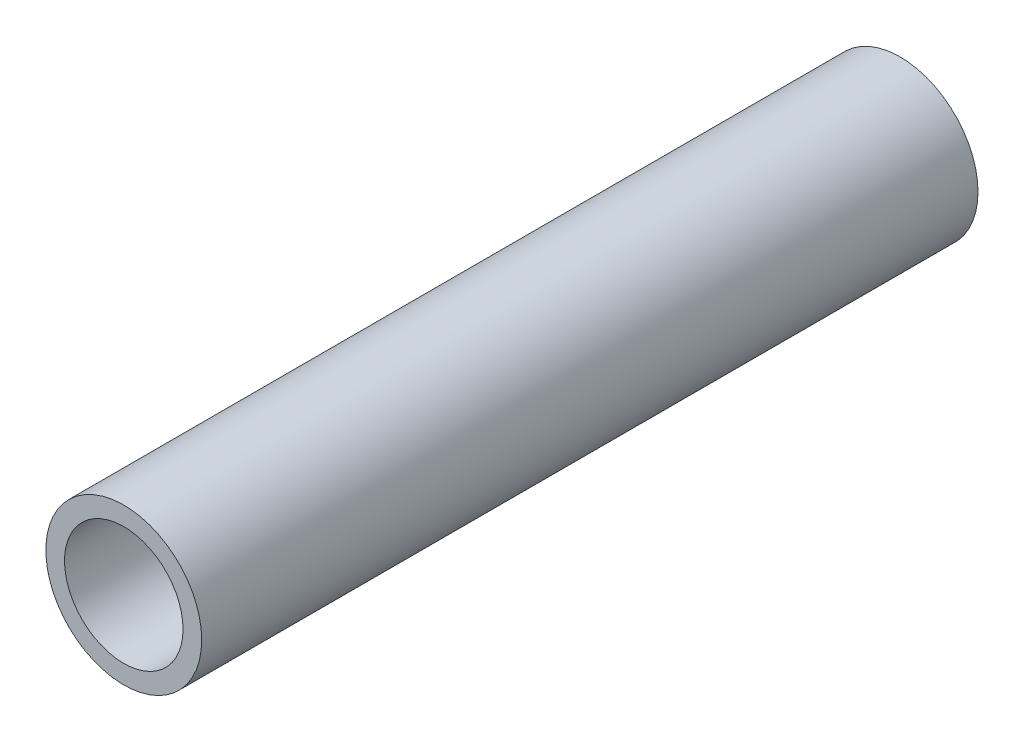
from build123d import *

# Parameters (mm, degrees)
SKETCH1_R           = 16.7005
SKETCH1_R_2         = 12.7
BOSS_EXTRUDE1_DEPTH = 166.37


with BuildPart() as part:
    # Sketch1 → Boss-Extrude1 (new body)
    with BuildSketch(Plane.XY):
        Circle(SKETCH1_R)
        Circle(SKETCH1_R_2, mode=Mode.SUBTRACT)
    extrude(amount=BOSS_EXTRUDE1_DEPTH)


solid = part.part
